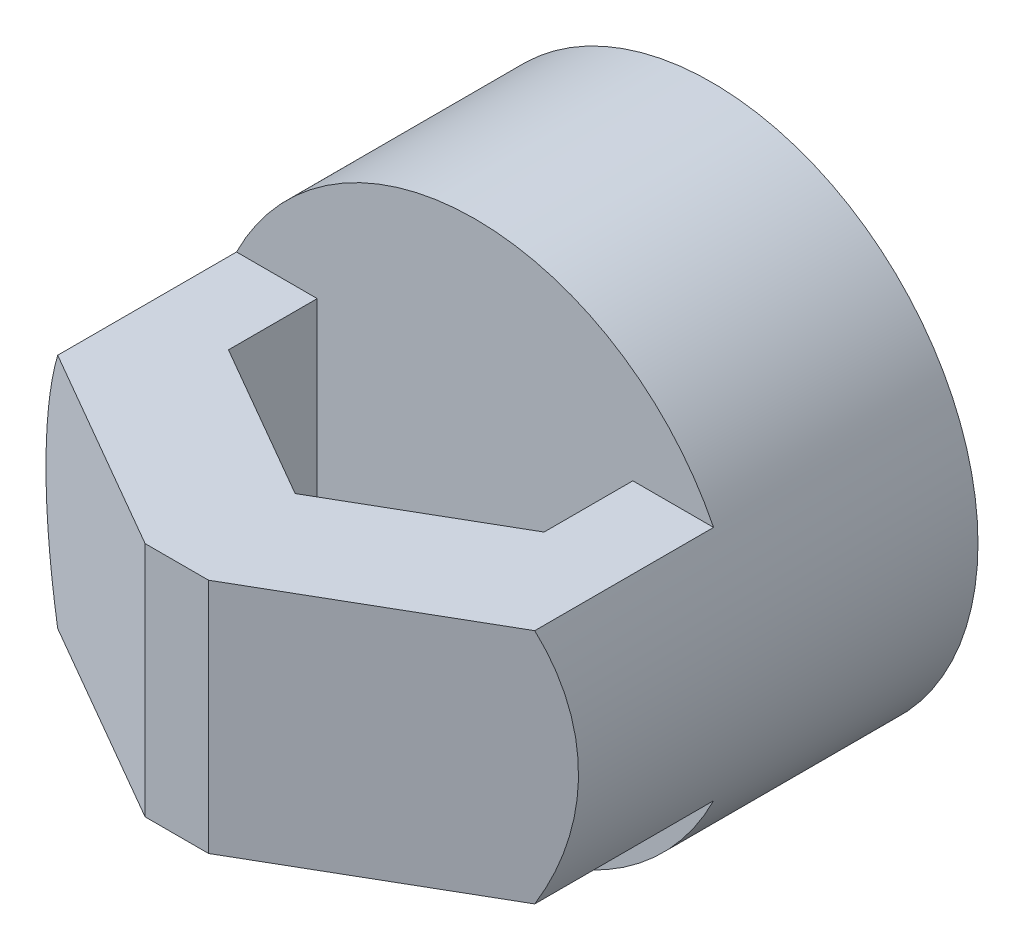
from build123d import *

# Parameters (mm, degrees)
SKETCH1_R           = 9
SKETCH1_R_2         = 5.5
BOSS_EXTRUDE1_DEPTH = 5
SKETCH2_R           = 9
BOSS_EXTRUDE2_DEPTH = 3
BOSS_EXTRUDE3_DEPTH = 4
SKETCH4_OUTSIDE_W   = 26.244
SKETCH4_OUTSIDE_H   = 26.244
SKETCH4_OUTSIDE_R   = 9
CUT_EXTRUDE1_DEPTH  = 17.235607036


with BuildPart() as part:
    # Sketch1 → Boss-Extrude1 (new body)
    with BuildSketch(Plane.XY):
        Circle(SKETCH1_R)
        Circle(SKETCH1_R_2, mode=Mode.SUBTRACT)
    extrude(amount=BOSS_EXTRUDE1_DEPTH)

    # Sketch2 → Boss-Extrude2 (add)
    with BuildSketch(Plane.XY.offset(5)):
        Circle(SKETCH2_R)
    extrude(amount=BOSS_EXTRUDE2_DEPTH)

    # Sketch3 → Boss-Extrude3 (add, symmetric)
    with BuildSketch(Plane(origin=(0, 0, 0), x_dir=(1, 0, 0), z_dir=(0, 1, 0))):
        Polygon((-5.333731513, -11), (-5.333731513, -8), (-9, -8), (-9, -13.502081056), (-1.07179677, -18.079431325), (1.07179677, -18.079431325), (9, -13.502081056), (9, -8), (5.333731513, -8), (5.333731513, -11), (0, -14.079431325), align=None)
    extrude(amount=BOSS_EXTRUDE3_DEPTH, both=True)

    # Sketch4 outside → Cut-Extrude1 (cut, through all)
    with BuildSketch(Plane.XY.offset(8)):
        Rectangle(SKETCH4_OUTSIDE_W, SKETCH4_OUTSIDE_H)
        with Locations(Location((0, 0, 0), (0, 0, 206.387799961))):
            Circle(SKETCH4_OUTSIDE_R, mode=Mode.SUBTRACT)
    extrude(amount=CUT_EXTRUDE1_DEPTH, mode=Mode.SUBTRACT)


solid = part.part
